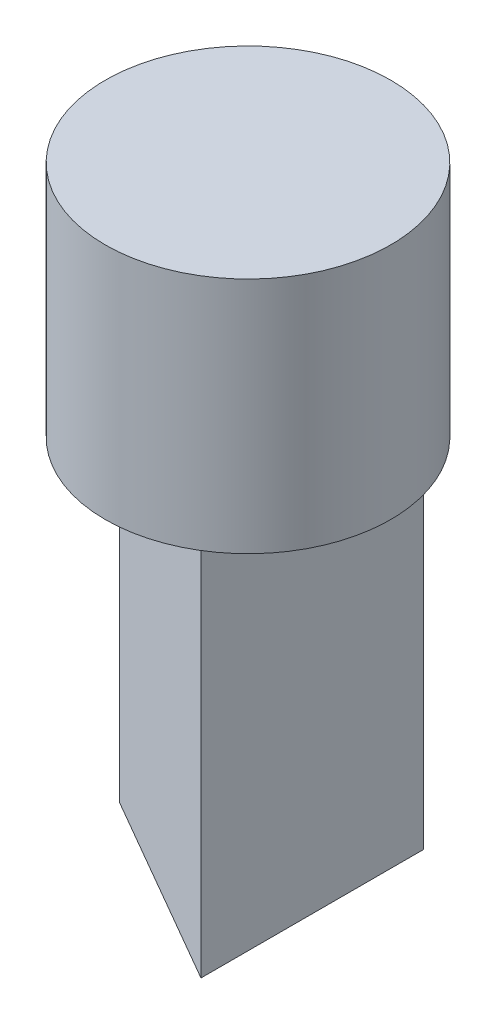
from build123d import *

# Parameters (mm, degrees)
SKETCH1_R           = 3
BOSS_EXTRUDE1_DEPTH = 5
BOSS_EXTRUDE2_DEPTH = 8


with BuildPart() as part:
    # Sketch1 → Boss-Extrude1 (new body)
    with BuildSketch(Plane(origin=(0, 0, 0), x_dir=(1, 0, 0), z_dir=(0, 1, 0))):
        with Locations(Location((0, 0, 0), (0, 0, 270))):
            Circle(SKETCH1_R)
    extrude(amount=BOSS_EXTRUDE1_DEPTH)

    # Sketch2 → Boss-Extrude2 (add)
    with BuildSketch(Plane.XZ):
        Polygon((1.35, -2.33826859), (1.35, 2.33826859), (-2.7, 0), align=None)
    extrude(amount=BOSS_EXTRUDE2_DEPTH)


solid = part.part
